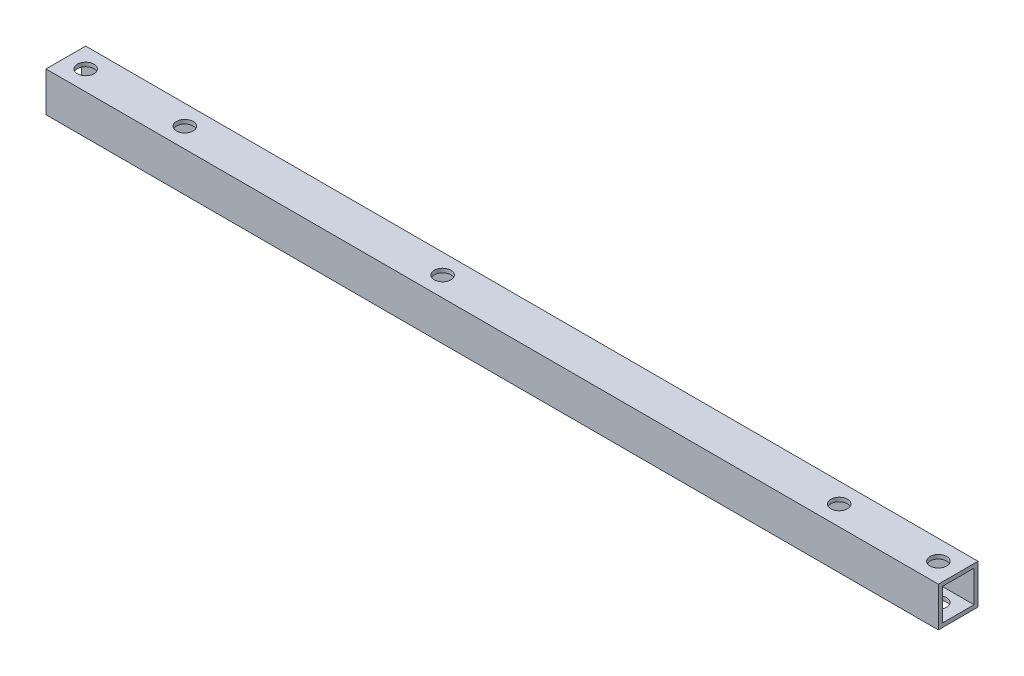
from build123d import *

# Parameters (mm, degrees)
SKETCH_1_W          = 10
SKETCH_1_H          = 10
SKETCH_1_W_2        = 8
SKETCH_1_H_2        = 8
EXTRUDE_1_DEPTH     = 225
SKETCH_2_R          = 2.1
CUT_EXTRUDE_1_DEPTH = 226.277606521
SKETCH_3_R          = 2.1
CUT_EXTRUDE_2_DEPTH = 226.277606521


with BuildPart() as part:
    # ｽｹｯﾁ1 → 押し出し-薄板1 (new body)
    with BuildSketch(Plane(origin=(0, 0, 0), x_dir=(0, 0, -1), z_dir=(1, 0, 0))):
        Rectangle(SKETCH_1_W, SKETCH_1_H)
        Rectangle(SKETCH_1_W_2, SKETCH_1_H_2, mode=Mode.SUBTRACT)
    extrude(amount=EXTRUDE_1_DEPTH)

    # ｽｹｯﾁ2 → ｶｯﾄ - 押し出し1 (cut, through all)
    with BuildSketch(Plane(origin=(0, 5, 0), x_dir=(1, 0, 0), z_dir=(0, 1, 0))):
        with Locations(Location((195, 0, 0), (0, 0, 270))):
            Circle(SKETCH_2_R)
        with Locations(Location((220, 0, 0), (0, 0, 270))):
            Circle(SKETCH_2_R)
        with Locations(Location((5, 0, 0), (0, 0, 270))):
            Circle(SKETCH_2_R)
        with Locations(Location((30, 0, 0), (0, 0, 270))):
            Circle(SKETCH_2_R)
    extrude(amount=-CUT_EXTRUDE_1_DEPTH, mode=Mode.SUBTRACT)

    # ｽｹｯﾁ3 → ｶｯﾄ - 押し出し2 (cut, through all)
    with BuildSketch(Plane(origin=(0, 5, 0), x_dir=(1, 0, 0), z_dir=(0, 1, 0))):
        with Locations(Location((95, 0, 0), (0, 0, 270))):
            Circle(SKETCH_3_R)
    extrude(amount=-CUT_EXTRUDE_2_DEPTH, mode=Mode.SUBTRACT)


solid = part.part
